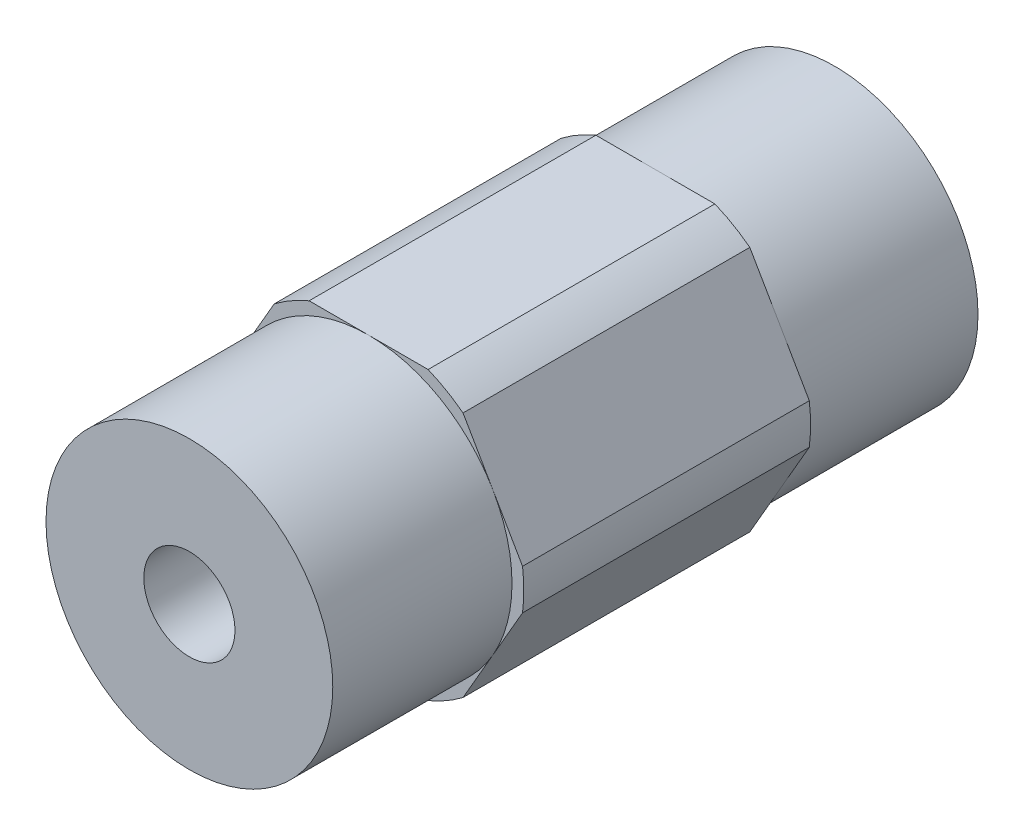
from build123d import *

# Parameters (mm, degrees)
SKETCH1_R                            = 2.0193
BOSS_EXTRUDE1_DEPTH                  = 14.2875
F_10_32_TAPPED_HOLE1_D               = 4.0386
F_10_32_TAPPED_HOLE1_DEPTH           = 11.938
F_10_32_TAPPED_HOLE1_TIP             = 1.213317848
F_10_32_TAPPED_HOLE1_ON_FACE_2_D     = 4.0386
F_10_32_TAPPED_HOLE1_ON_FACE_2_DEPTH = 11.938
F_10_32_TAPPED_HOLE1_ON_FACE_2_TIP   = 1.213317848
SKETCH4_R                            = 8.89
SKETCH4_R_2                          = 6.35
CUT_EXTRUDE_THIN1_DEPTH              = 7.9375


with BuildPart() as part:
    # Sketch1 → Boss-Extrude1 (new, symmetric)
    with BuildSketch(Plane.XY):
        with BuildLine():
            ThreePointArc((6.874999966, 0), (6.860422465, 0.447468582), (6.816751782, 0.893039571))
            Line((6.816751782, 0.893039571), (4.181770846, 5.456960429))
            ThreePointArc((4.181770846, 5.456960429), (3.437499983, 5.953924622), (2.634980936, 6.35))
            Line((2.634980936, 6.35), (-2.634980936, 6.35))
            ThreePointArc((-2.634980936, 6.35), (-3.437499983, 5.953924622), (-4.181770846, 5.456960429))
            Line((-4.181770846, 5.456960429), (-6.816751782, 0.893039571))
            ThreePointArc((-6.816751782, 0.893039571), (-6.874999966, 0), (-6.816751782, -0.893039571))
            Line((-6.816751782, -0.893039571), (-4.181770846, -5.456960429))
            ThreePointArc((-4.181770846, -5.456960429), (-3.437499983, -5.953924622), (-2.634980936, -6.35))
            Line((-2.634980936, -6.35), (2.634980936, -6.35))
            ThreePointArc((2.634980936, -6.35), (3.437499983, -5.953924622), (4.181770846, -5.456960429))
            Line((4.181770846, -5.456960429), (6.816751782, -0.893039571))
            ThreePointArc((6.816751782, -0.893039571), (6.860422465, -0.447468582), (6.874999966, 0))
        make_face()
        Circle(SKETCH1_R, mode=Mode.SUBTRACT)
    extrude(amount=BOSS_EXTRUDE1_DEPTH, both=True)

    # #10-32 Tapped Hole1
    with Locations(Plane.XY.offset(14.2875)):
        with Locations((0, 0)):
            Hole(F_10_32_TAPPED_HOLE1_D / 2, depth=F_10_32_TAPPED_HOLE1_DEPTH)
            with Locations((0, 0, -(F_10_32_TAPPED_HOLE1_DEPTH + F_10_32_TAPPED_HOLE1_TIP / 2))):  # 118° drill point
                Cone(0, F_10_32_TAPPED_HOLE1_D / 2, F_10_32_TAPPED_HOLE1_TIP, mode=Mode.SUBTRACT)

    # #10-32 Tapped Hole1 on face 2
    with Locations(Plane.XY.offset(-14.2875)):
        with Locations((0, 0)):
            Hole(F_10_32_TAPPED_HOLE1_ON_FACE_2_D / 2, depth=F_10_32_TAPPED_HOLE1_ON_FACE_2_DEPTH)
            with Locations((0, 0, -(F_10_32_TAPPED_HOLE1_ON_FACE_2_DEPTH + F_10_32_TAPPED_HOLE1_ON_FACE_2_TIP / 2))):  # 118° drill point
                Cone(0, F_10_32_TAPPED_HOLE1_ON_FACE_2_D / 2, F_10_32_TAPPED_HOLE1_ON_FACE_2_TIP, mode=Mode.SUBTRACT)

    # Sketch4 → Cut-Extrude-Thin1 (cut)
    with BuildSketch(Plane.XY.offset(14.2875)):
        Circle(SKETCH4_R)
        Circle(SKETCH4_R_2, mode=Mode.SUBTRACT)
    cut_extrude_thin1 = extrude(amount=-CUT_EXTRUDE_THIN1_DEPTH, mode=Mode.SUBTRACT)

    # Mirror1: Cut-Extrude-Thin1 across plane
    add(cut_extrude_thin1.mirror(Plane.XY), mode=Mode.SUBTRACT)


solid = part.part
